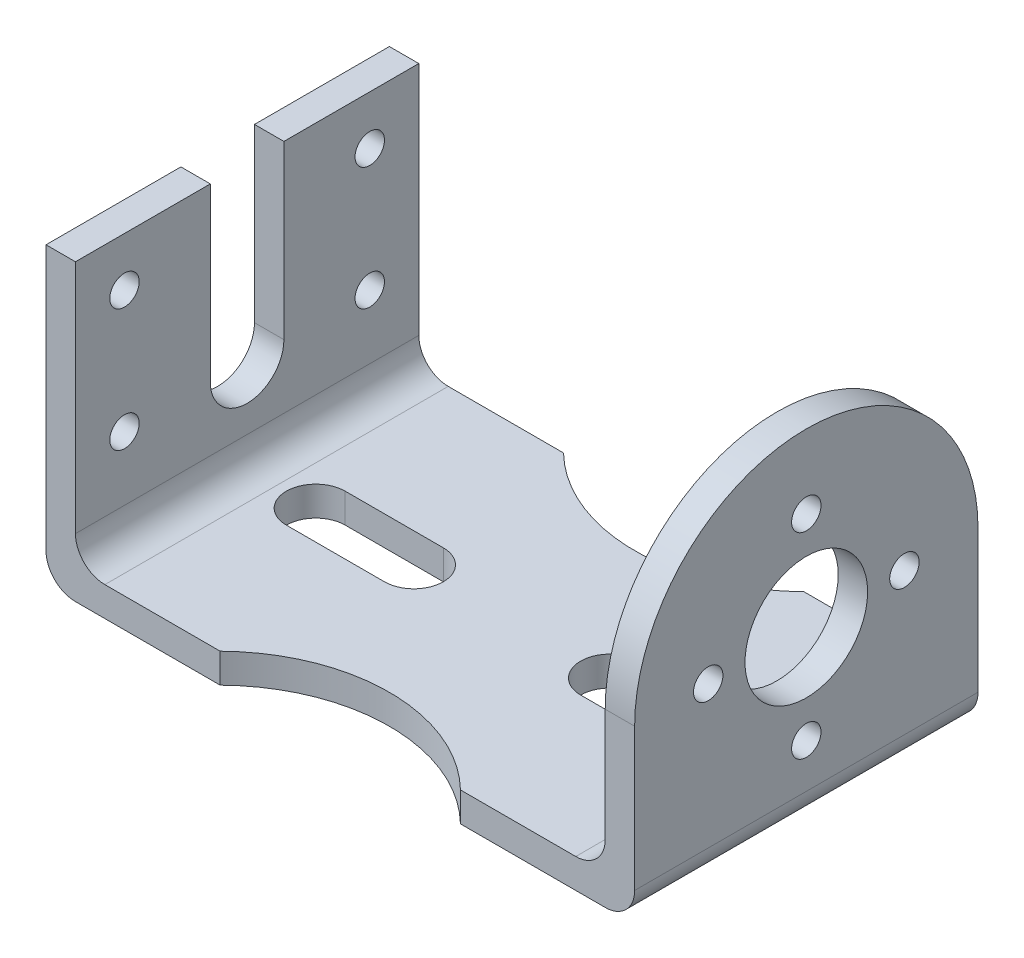
from build123d import *
from build123d.topology import SkipClean

# Parameters (mm, degrees)
BASEPLATEEXTRUDE_DEPTH = 70
FEATUREOP1_DEPTH       = 33
FEATUREOP2_DEPTH       = 6
SKETCH4_R              = 12.5
FEATUREOP3_DEPTH       = 16
SKETCH5_R              = 3
FEATUREOP4_DEPTH       = 16
SKETCH6_R              = 3
FEATUREOP5_DEPTH       = 16
FEATUREOP6_DEPTH       = 16


with BuildPart() as part:
    # Sketch1 → BasePlateExtrude (new body)
    with BuildSketch(Plane.XY):
        with BuildLine():
            Line((-54, 0), (54, 0))
            ThreePointArc((54, 0), (58.242640687, 1.757359313), (60, 6))
            Line((60, 6), (60, 60))
            Line((60, 60), (54, 60))
            Line((54, 60), (54, 12))
            ThreePointArc((54, 12), (52.242640687, 7.757359313), (48, 6))
            Line((48, 6), (-48, 6))
            ThreePointArc((-48, 6), (-52.242640687, 7.757359313), (-54, 12))
            Line((-54, 12), (-54, 60))
            Line((-54, 60), (-60, 60))
            Line((-60, 60), (-60, 6))
            ThreePointArc((-60, 6), (-58.242640687, 1.757359313), (-54, 0))
        make_face()
    extrude(amount=-BASEPLATEEXTRUDE_DEPTH)

    # Sketch2 → FeatureOp1 (cut)
    with BuildSketch(Plane(origin=(60, 0, 0), x_dir=(0, 0, -1), z_dir=(1, 0, 0))):
        with BuildLine():
            Line((0, 35), (0, 60))
            Line((0, 60), (10.505102572, 60))
            ThreePointArc((10.505102572, 60), (2.732978058, 48.558735008), (0, 35))
        make_face()
        with BuildLine():
            Line((70, 35), (70, 60))
            Line((70, 60), (59.494897428, 60))
            ThreePointArc((59.494897428, 60), (67.267021942, 48.558735008), (70, 35))
        make_face()
    extrude(amount=-FEATUREOP1_DEPTH, mode=Mode.SUBTRACT)

    # Sketch3 → FeatureOp2 (add)
    with SkipClean():  # the faces are left unmerged after this step: merging them gives an invalid solid
        with BuildSketch(Plane(origin=(60, 0, 0), x_dir=(0, 0, -1), z_dir=(1, 0, 0))):
            with BuildLine():
                Line((10.505102572, 60), (59.494897428, 60))
                ThreePointArc((59.494897428, 60), (35, 70), (10.505102572, 60))
            make_face()
        extrude(amount=-FEATUREOP2_DEPTH)

    # Sketch4 → FeatureOp3 (cut)
    with SkipClean():  # the faces are left unmerged after this step: merging them gives an invalid solid
        with BuildSketch(Plane(origin=(60, 0, 0), x_dir=(0, 0, -1), z_dir=(1, 0, 0))):
            with Locations((35, 35)):
                Circle(SKETCH4_R)
        extrude(amount=-FEATUREOP3_DEPTH, mode=Mode.SUBTRACT)

    # Sketch5 → FeatureOp4 (cut)
    with SkipClean():  # the faces are left unmerged after this step: merging them gives an invalid solid
        with BuildSketch(Plane(origin=(60, 0, 0), x_dir=(0, 0, -1), z_dir=(1, 0, 0))):
            with Locations((35, 55)):
                Circle(SKETCH5_R)
            with Locations((55, 35)):
                Circle(SKETCH5_R)
            with Locations((35, 15)):
                Circle(SKETCH5_R)
            with Locations((15, 35)):
                Circle(SKETCH5_R)
        extrude(amount=-FEATUREOP4_DEPTH, mode=Mode.SUBTRACT)

    # Sketch6 → FeatureOp5 (cut)
    with SkipClean():  # the faces are left unmerged after this step: merging them gives an invalid solid
        with BuildSketch(Plane.ZY.offset(60)):
            with Locations((-60, 50)):
                Circle(SKETCH6_R)
            with Locations((-60, 25)):
                Circle(SKETCH6_R)
            with Locations((-10, 50)):
                Circle(SKETCH6_R)
            with Locations((-10, 25)):
                Circle(SKETCH6_R)
            with BuildLine():
                Line((-42.5, 60), (-27.5, 60))
                Line((-27.5, 60), (-27.5, 25))
                ThreePointArc((-27.5, 25), (-35, 17.5), (-42.5, 25))
                Line((-42.5, 25), (-42.5, 60))
            make_face()
        extrude(amount=-FEATUREOP5_DEPTH, mode=Mode.SUBTRACT)

    # Sketch7 → FeatureOp6 (cut)
    with SkipClean():  # the faces are left unmerged after this step: merging them gives an invalid solid
        with BuildSketch(Plane(origin=(0, 6, 0), x_dir=(1, 0, 0), z_dir=(0, 1, 0))):
            with BuildLine():
                Line((-40, 41), (-20, 41))
                ThreePointArc((-20, 41), (-14, 35), (-20, 29))
                Line((-20, 29), (-40, 29))
                ThreePointArc((-40, 29), (-46, 35), (-40, 41))
            make_face()
            with BuildLine():
                Line((20, 29), (40, 29))
                ThreePointArc((40, 29), (46, 35), (40, 41))
                Line((40, 41), (20, 41))
                ThreePointArc((20, 41), (14, 35), (20, 29))
            make_face()
            with BuildLine():
                Line((-24.494897428, 0), (24.494897428, 0))
                ThreePointArc((24.494897428, 0), (0, 10), (-24.494897428, 0))
            make_face()
            with BuildLine():
                Line((-24.494897428, 70), (24.494897428, 70))
                ThreePointArc((24.494897428, 70), (0, 60), (-24.494897428, 70))
            make_face()
        extrude(amount=-FEATUREOP6_DEPTH, mode=Mode.SUBTRACT)


solid = part.part
